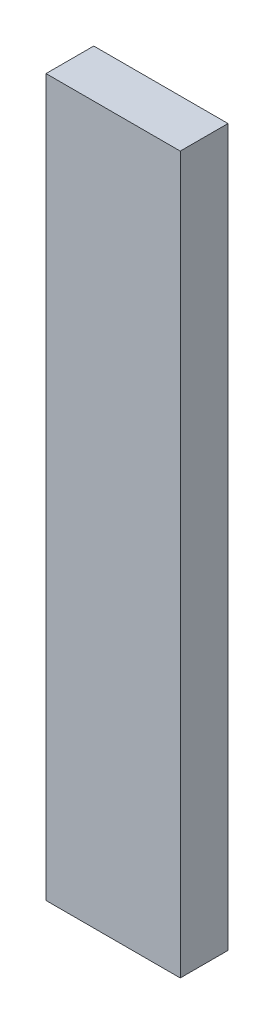
from build123d import *

# Parameters (mm, degrees)
SKETCH1_W           = 22.496
SKETCH1_H           = 120
BOSS_EXTRUDE1_DEPTH = 8


with BuildPart() as part:
    # Sketch1 → Boss-Extrude1 (new body)
    with BuildSketch(Plane.XY):
        Rectangle(SKETCH1_W, SKETCH1_H)
    extrude(amount=BOSS_EXTRUDE1_DEPTH)


solid = part.part
